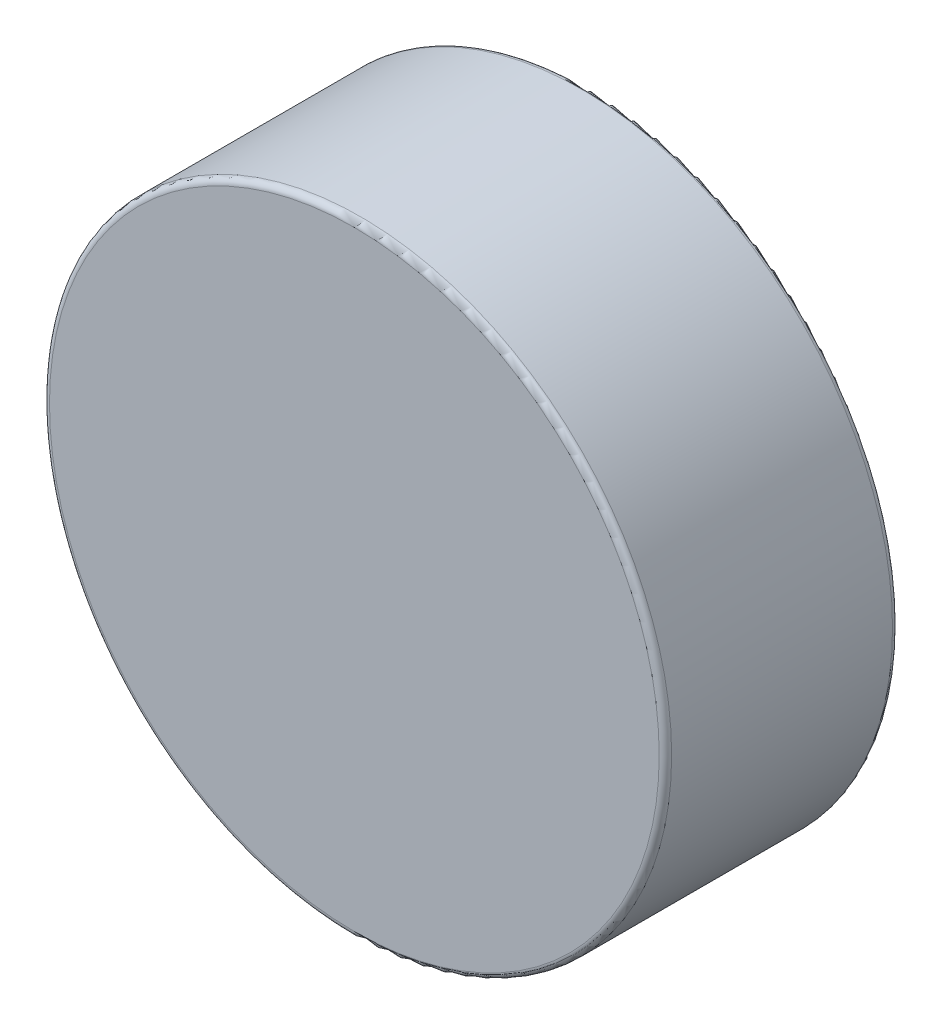
from build123d import *

# Parameters (mm, degrees)
BOSS_EXTRUDE1_DEPTH      = 2.38125
BOSS_EXTRUDE1_DEPTH_BACK = 2.38125
SKETCH3_R                = 6.35
FILLET1_R                = 0.127


with BuildPart() as part:
    # Sketch3 → Boss-Extrude1 (new, two sides: drawn at the far end of the back side and taken through both)
    with BuildSketch(Plane.XY.offset(-BOSS_EXTRUDE1_DEPTH_BACK)):
        Circle(SKETCH3_R)
    extrude(amount=BOSS_EXTRUDE1_DEPTH + BOSS_EXTRUDE1_DEPTH_BACK)

    # Fillet1
    fillet1_edges = [part.edges().sort_by_distance(p)[0] for p in [
        (-6.35, 0, -2.38125),
        (-6.35, 0, 2.38125),
    ]]
    fillet(fillet1_edges, radius=FILLET1_R)


solid = part.part
